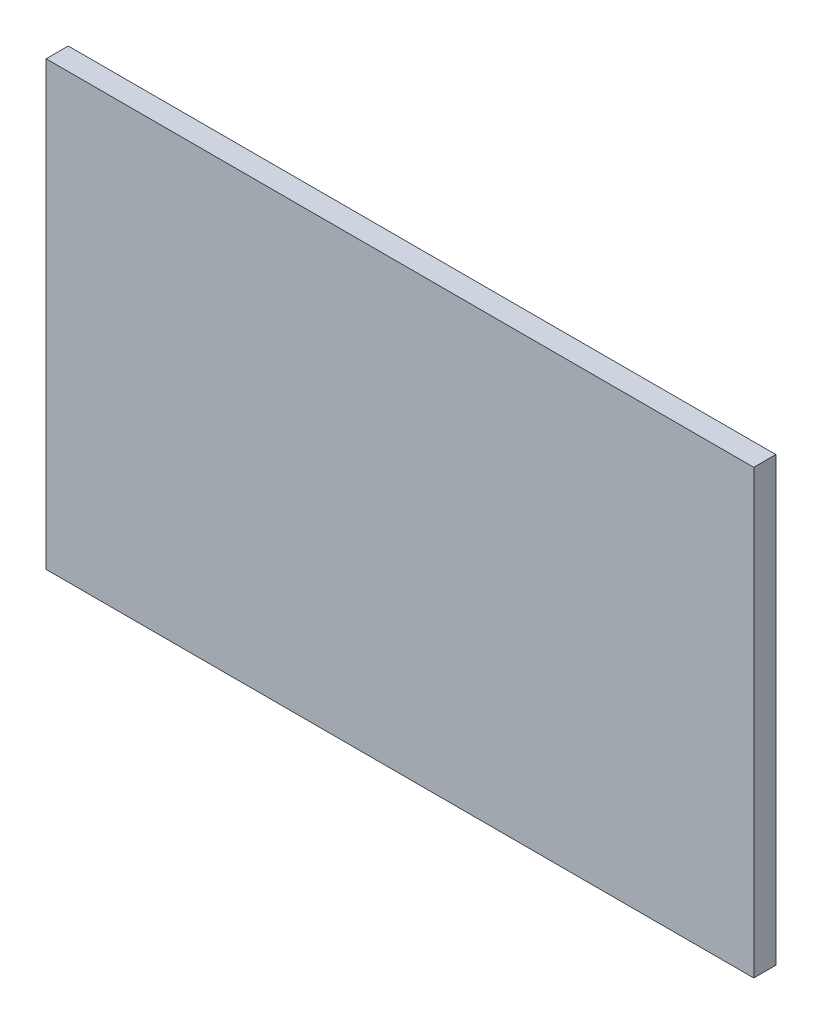
from build123d import *

# Parameters (mm, degrees)
SKETCH2_W           = 800
SKETCH2_H           = 500
BOSS_EXTRUDE1_DEPTH = 25


with BuildPart() as part:
    # Sketch2 → Boss-Extrude1 (new body)
    with BuildSketch(Plane.XY):
        Rectangle(SKETCH2_W, SKETCH2_H)
    extrude(amount=BOSS_EXTRUDE1_DEPTH)


solid = part.part
